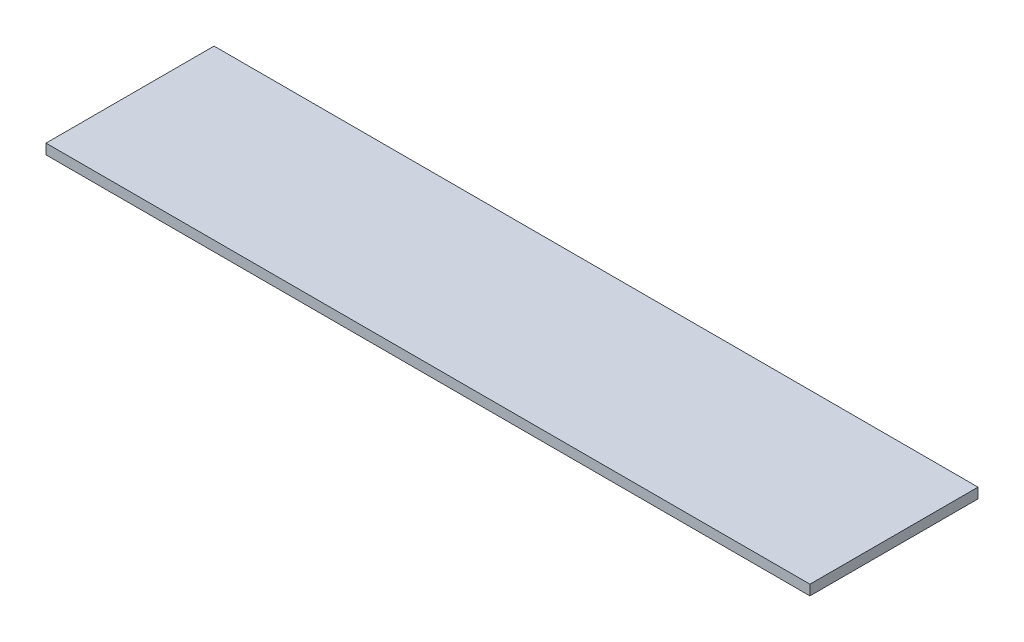
from build123d import *

# Parameters (mm, degrees)
SKETCH1_W           = 150
SKETCH1_H           = 33
BOSS_EXTRUDE1_DEPTH = 1


with BuildPart() as part:
    # Sketch1 → Boss-Extrude1 (new, symmetric)
    with BuildSketch(Plane(origin=(0, 0, 0), x_dir=(1, 0, 0), z_dir=(0, 1, 0))):
        Rectangle(SKETCH1_W, SKETCH1_H)
    extrude(amount=BOSS_EXTRUDE1_DEPTH, both=True)


solid = part.part
